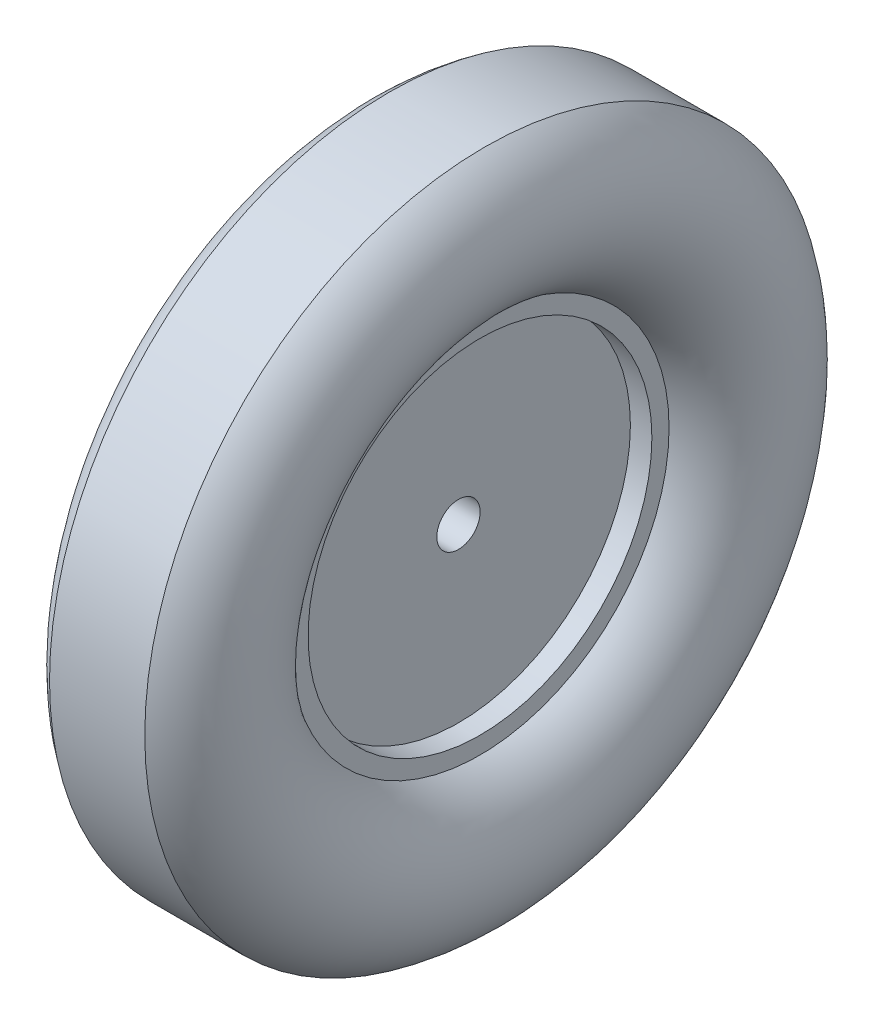
from build123d import *

# Parameters (mm, degrees)
SCALE1_SCALE = 1.5


with BuildPart() as part:
    # Sketch1 → Revolve1 (revolve)
    with BuildSketch(Plane.XY, mode=Mode.PRIVATE) as revolve1_sk:
        with BuildLine():
            Line((12.7, 12.80502263), (12.7, 101.6))
            Line((12.7, 101.6), (25.399381994, 101.6))
            Line((25.399381994, 101.6), (25.399381994, 111.76))
            ThreePointArc((25.399381994, 111.76), (51.978144098, 155.533163358), (28.151294552, 200.863083566))
            Line((28.151294552, 200.863083566), (-0.000618006, 200.863083566))
            Line((-0.000618006, 200.863083566), (-28.152530564, 200.863083566))
            ThreePointArc((-28.152530564, 200.863083566), (-51.97938011, 155.533163358), (-25.400618006, 111.76))
            Line((-25.400618006, 111.76), (-25.400618006, 101.6))
            Line((-25.400618006, 101.6), (-12.7, 101.6))
            Line((-12.7, 101.6), (-12.7, 12.80502263))
            Line((-12.7, 12.80502263), (12.7, 12.80502263))
        make_face()
    revolve(revolve1_sk.sketch.rotate(Axis((12.7, 0, 0), (-1, 0, 0)), 90), axis=Axis((12.7, 0, 0), (-1, 0, 0)))


with BuildPart() as part_1:
    # Scale1: scaled about (-0.000562241, 0, 0)
    add(part.part.scale(SCALE1_SCALE).moved(Location((0.00028112, 0, 0))))


solid = part_1.part
